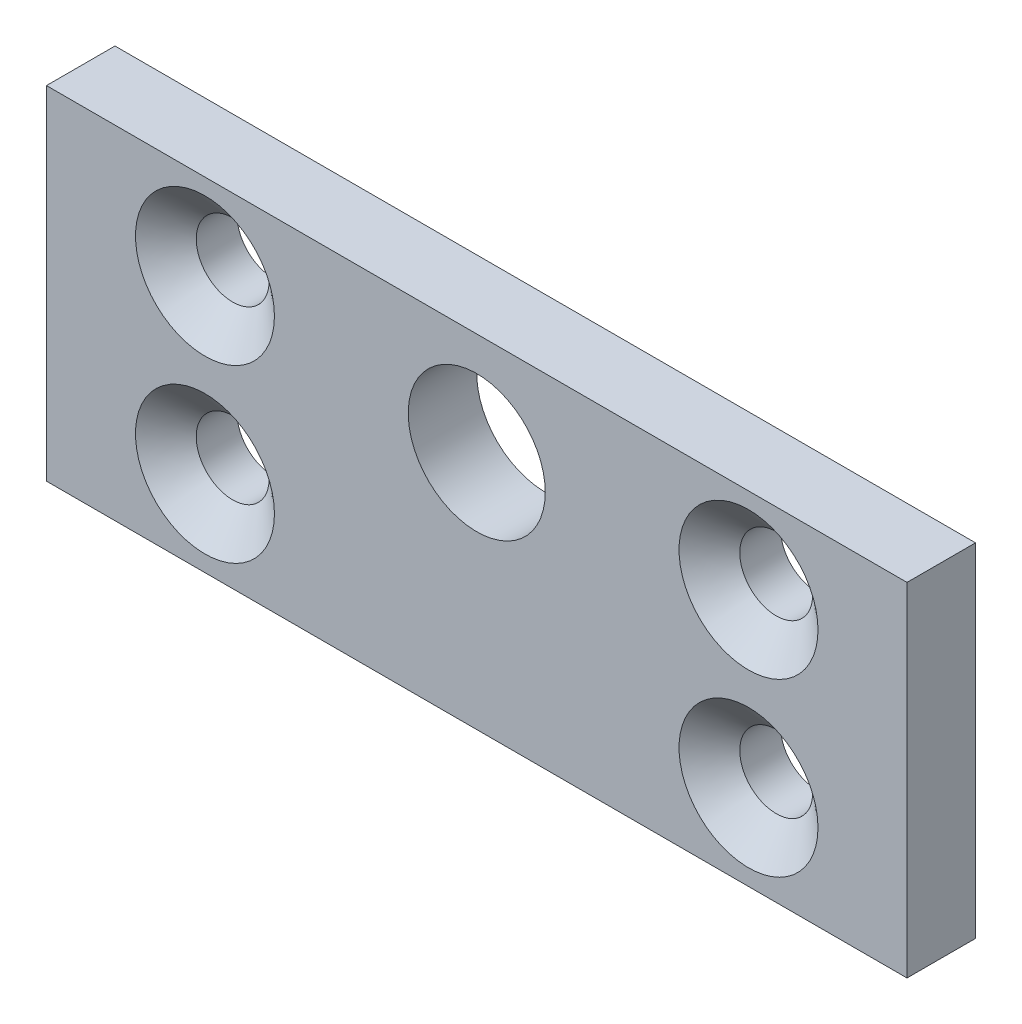
from build123d import *

# Parameters (mm, degrees)
SKETCH1_W                                           = 79.746162722
SKETCH1_H                                           = 31.75
SKETCH1_R                                           = 6.35
BOSS_EXTRUDE1_DEPTH                                 = 6.35
CSK_FOR_1_4_FLAT_HEAD_MACHINE_SCREW_100_D           = 6.7564
CSK_FOR_1_4_FLAT_HEAD_MACHINE_SCREW_100_CSINK_D     = 12.8778
CSK_FOR_1_4_FLAT_HEAD_MACHINE_SCREW_100_CSINK_ANGLE = 100


with BuildPart() as part:
    # Sketch1 → Boss-Extrude1 (new body)
    with BuildSketch(Plane.XY):
        with Locations((-63.5, 15.875)):
            Rectangle(SKETCH1_W, SKETCH1_H)
        with Locations((-63.5, 22.225)):
            Circle(SKETCH1_R, mode=Mode.SUBTRACT)
    extrude(amount=BOSS_EXTRUDE1_DEPTH)

    # CSK for 1/4 Flat Head Machine Screw (100)1 (through all)
    with Locations(Plane.XY.offset(6.35)):
        with Locations((-88.685760173, 23.8125), (-88.685760173, 7.9375), (-38.314239827, 7.9375), (-38.314239827, 23.8125)):
            CounterSinkHole(CSK_FOR_1_4_FLAT_HEAD_MACHINE_SCREW_100_D / 2, CSK_FOR_1_4_FLAT_HEAD_MACHINE_SCREW_100_CSINK_D / 2, counter_sink_angle=CSK_FOR_1_4_FLAT_HEAD_MACHINE_SCREW_100_CSINK_ANGLE)


solid = part.part
